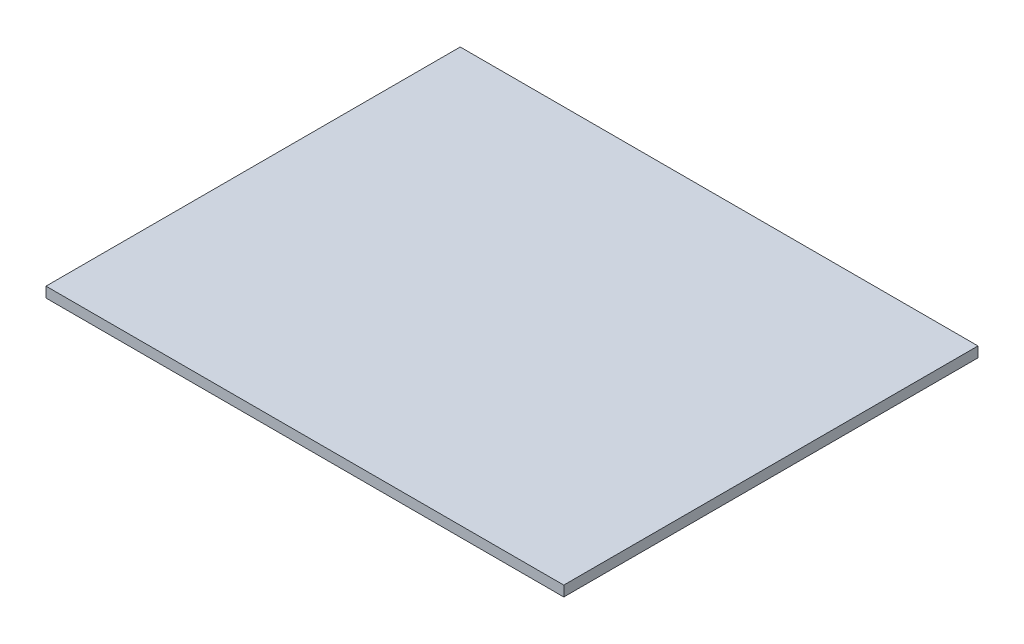
from build123d import *

# Parameters (mm, degrees)
SKETCH_1_W      = 500
SKETCH_1_H      = 10
EXTRUDE_1_DEPTH = 200


with BuildPart() as part:
    # 草图1 → 拉伸-薄壁1 (new, symmetric)
    with BuildSketch(Plane.XY):
        with Locations((-100, -8.5)):
            Rectangle(SKETCH_1_W, SKETCH_1_H)
    extrude(amount=EXTRUDE_1_DEPTH, both=True)


solid = part.part
